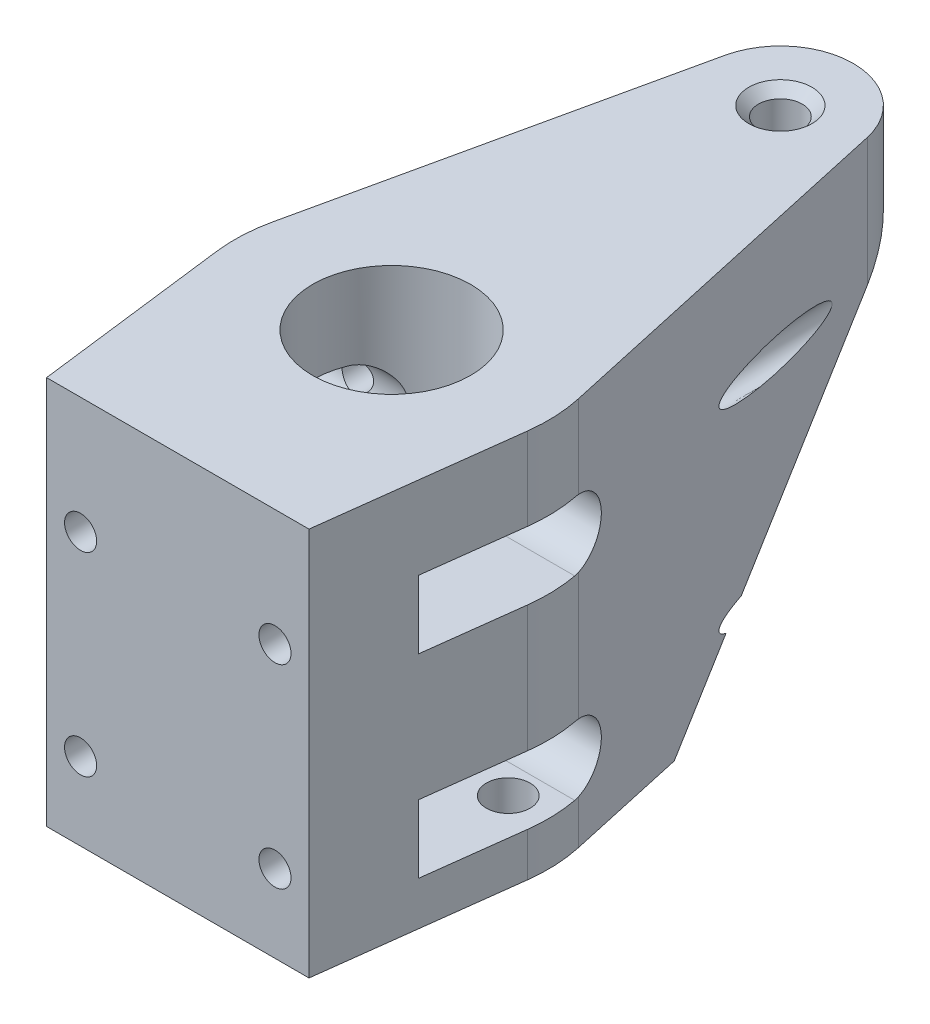
from build123d import *

# Parameters (mm, degrees)
SKETCH1_R                      = 2.25
SKETCH1_R_2                    = 8.125
BOSS_EXTRUDE1_DEPTH            = 44
CUT_EXTRUDE1_DEPTH             = 4
CUT_EXTRUDE3_DEPTH             = 84.822822817
CUT_EXTRUDE3_DEPTH_BACK        = 84.822822817
F_4_5_4_5_DIAMETER_HOLE1_D     = 4.5
F_4_5_4_5_DIAMETER_HOLE1_DEPTH = 10
F_4_5_4_5_DIAMETER_HOLE1_TIP   = 1.351936393
F_3_3_3_3_DIAMETER_HOLE1_D     = 3.3
CUT_EXTRUDE4_DEPTH             = 84.822822817
CUT_EXTRUDE4_DEPTH_BACK        = 84.822822817
CHAMFER1_SIZE                  = 1


with BuildPart() as part:
    # Sketch1 → Boss-Extrude1 (new body)
    with BuildSketch(Plane(origin=(0, 0, 0), x_dir=(1, 0, 0), z_dir=(0, 1, 0))):
        with BuildLine():
            Line((-7.323571846, 63.6171875), (-15.74567947, 25.476953125))
            ThreePointArc((-15.74567947, 25.476953125), (-16.107587682, 22.749162244), (-16.000432679, 19.99955528))
            Line((-16.000432679, 19.99955528), (-13.5, 0))
            Line((-13.5, 0), (13.5, 0))
            Line((13.5, 0), (16.000432679, 19.99955528))
            ThreePointArc((16.000432679, 19.99955528), (16.107587682, 22.749162244), (15.74567947, 25.476953125))
            Line((15.74567947, 25.476953125), (7.323571846, 63.6171875))
            ThreePointArc((7.323571846, 63.6171875), (0, 69.5), (-7.323571846, 63.6171875))
        make_face()
        with Locations(Location((0, 62, 0), (0, 0, 270))):
            Circle(SKETCH1_R, mode=Mode.SUBTRACT)
        with Locations(Location((0, 22, 0), (0, 0, 270))):
            Circle(SKETCH1_R_2, mode=Mode.SUBTRACT)
    extrude(amount=BOSS_EXTRUDE1_DEPTH)

    # Sketch2 → Cut-Extrude1 (cut)
    with BuildSketch(Plane.XZ):
        with BuildLine():
            Line((-15.74567947, -25.476953125), (-12.952744037, -38.125))
            Line((-12.952744037, -38.125), (12.952744037, -38.125))
            Line((12.952744037, -38.125), (15.74567947, -25.476953125))
            ThreePointArc((15.74567947, -25.476953125), (16.107587682, -22.749162244), (16.000432679, -19.99955528))
            Line((16.000432679, -19.99955528), (13.5, 0))
            Line((13.5, 0), (-13.5, 0))
            Line((-13.5, 0), (-16.000432679, -19.99955528))
            ThreePointArc((-16.000432679, -19.99955528), (-16.107587682, -22.749162244), (-15.74567947, -25.476953125))
        make_face()
    extrude(amount=-CUT_EXTRUDE1_DEPTH, mode=Mode.SUBTRACT)

    # Sketch3 → Cut-Extrude3 (cut, two sides: drawn at the far end of the back side and taken through both)
    with BuildSketch(Plane(origin=(0, 0, 0), x_dir=(0, 0, -1), z_dir=(1, 0, 0)).offset(-CUT_EXTRUDE3_DEPTH_BACK)):
        Polygon((69.5, 37), (69.5, 0), (38.125, 0), (38.125, 4), align=None)
    extrude(amount=CUT_EXTRUDE3_DEPTH + CUT_EXTRUDE3_DEPTH_BACK, mode=Mode.SUBTRACT)

    # Ø4.5 (4.5) Diameter Hole1
    with Locations(Plane(origin=(0, 4, 0), x_dir=(-1, 0, 0), z_dir=(0, -1, 0))):
        with Locations((12, 22), (0, 34), (-12, 22), (0, 10)):
            Hole(F_4_5_4_5_DIAMETER_HOLE1_D / 2, depth=F_4_5_4_5_DIAMETER_HOLE1_DEPTH)
            with Locations((0, 0, -(F_4_5_4_5_DIAMETER_HOLE1_DEPTH + F_4_5_4_5_DIAMETER_HOLE1_TIP / 2))):  # 118° drill point
                Cone(0, F_4_5_4_5_DIAMETER_HOLE1_D / 2, F_4_5_4_5_DIAMETER_HOLE1_TIP, mode=Mode.SUBTRACT)

    # Ø3.3 (3.3) Diameter Hole1 (through all)
    with Locations(Plane.XY):
        with Locations((-10, 32), (10, 32), (10, 12), (-10, 12)):
            Hole(F_3_3_3_3_DIAMETER_HOLE1_D / 2)

    # Sketch10 → Cut-Extrude4 (cut, two sides: drawn at the far end of the back side and taken through both)
    with BuildSketch(Plane(origin=(0, 0, 0), x_dir=(0, 0, -1), z_dir=(1, 0, 0)).offset(-CUT_EXTRUDE4_DEPTH_BACK)):
        with BuildLine():
            Line((10, 35.5), (25, 35.5))
            ThreePointArc((25, 35.5), (28.5, 32), (25, 28.5))
            Line((25, 28.5), (10, 28.5))
            Line((10, 28.5), (10, 35.5))
        make_face()
        with BuildLine():
            Line((10, 15.5), (25, 15.5))
            ThreePointArc((25, 15.5), (28.5, 12), (25, 8.5))
            Line((25, 8.5), (10, 8.5))
            Line((10, 8.5), (10, 15.5))
        make_face()
    extrude(amount=CUT_EXTRUDE4_DEPTH + CUT_EXTRUDE4_DEPTH_BACK, mode=Mode.SUBTRACT)

    # Chamfer1
    chamfer1_edges = [part.edges().sort_by_distance(p)[0] for p in [
        (-14.25, 4, -22),
        (0, 44, -64.25),
        (-2.25, 4, -10),
        (9.75, 4, -22),
        (-2.25, 4, -34),
    ]]
    chamfer(chamfer1_edges, length=CHAMFER1_SIZE)


solid = part.part
